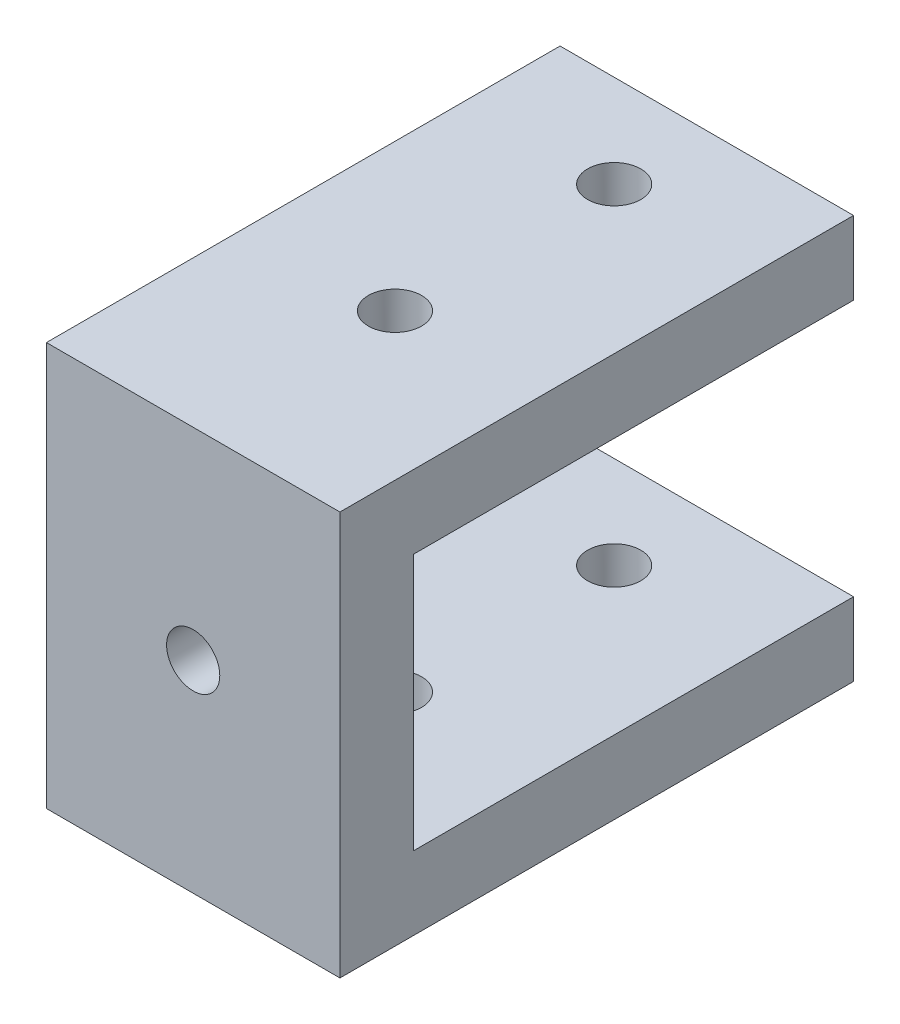
from build123d import *

# Parameters (mm, degrees)
BOSS_EXTRUDE1_DEPTH     = 20.32
CUT_EXTRUDE1_REACH      = 45.273
SKETCH2_R               = 1.8415
CUT_EXTRUDE2_DEPTH      = 47.071427154
CUT_EXTRUDE2_DEPTH_BACK = 47.071427154
SKETCH3_R               = 1.8415


with BuildPart() as part:
    # Sketch1 → Boss-Extrude1 (new body)
    with BuildSketch(Plane(origin=(0, 0, 0), x_dir=(0, 0, -1), z_dir=(1, 0, 0))):
        Polygon((0, 8.89), (0, -8.89), (30.48, -8.89), (30.48, -13.97), (-5.08, -13.97), (-5.08, 13.97), (30.48, 13.97), (30.48, 8.89), align=None)
    extrude(amount=BOSS_EXTRUDE1_DEPTH)

    # Sketch2 → Cut-Extrude1 (cut, up to next)
    with BuildSketch(Plane.XY.offset(5.08), mode=Mode.PRIVATE) as cut_extrude1_sk1:
        with Locations((10.16, 0)):
            Circle(SKETCH2_R)
    cut_extrude1_tool1 = extrude(cut_extrude1_sk1.sketch, amount=-CUT_EXTRUDE1_REACH, mode=Mode.PRIVATE) & part.part
    add(cut_extrude1_tool1.solids().sort_by_distance((10.16, 0, 5.08))[0], mode=Mode.SUBTRACT)

    # Sketch3 → Cut-Extrude2 (cut, two sides: drawn at the far end of the back side and taken through both)
    with BuildSketch(Plane(origin=(0, 13.97, 0), x_dir=(1, 0, 0), z_dir=(0, 1, 0)).offset(-CUT_EXTRUDE2_DEPTH_BACK)):
        with Locations(Location((10.16, 8.89, 0), (0, 0, 270))):
            Circle(SKETCH3_R)
        with Locations(Location((10.16, 24.0665, 0), (0, 0, 270))):
            Circle(SKETCH3_R)
    extrude(amount=CUT_EXTRUDE2_DEPTH + CUT_EXTRUDE2_DEPTH_BACK, mode=Mode.SUBTRACT)


solid = part.part
